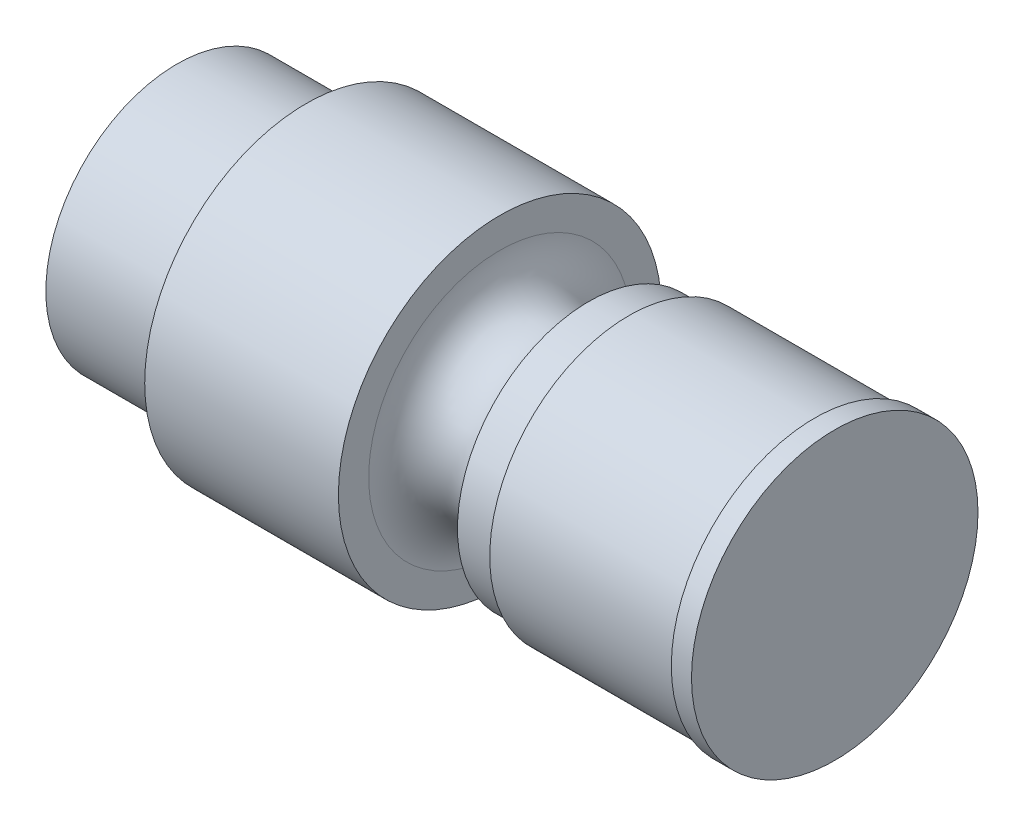
from build123d import *


with BuildPart() as part:
    # Sketch1 → Revolve1 (revolve)
    with BuildSketch(Plane.XY, mode=Mode.PRIVATE) as revolve1_sk:
        with BuildLine():
            Line((0, 0), (32, 0))
            Line((32, 0), (32, -7.5))
            Line((32, -7.5), (80, -7.5))
            Line((80, -7.5), (80, 0))
            ThreePointArc((80, 0), (91, 11), (102, 0))
            Line((102, 0), (112, 0))
            Line((112, 0), (112, -2))
            Line((112, -2), (158, -2))
            Line((158, -2), (158, -3))
            Line((158, -3), (163, -3))
            Line((163, -3), (163, 32.5))
            Line((163, 32.5), (0, 32.5))
            Line((0, 32.5), (0, 0))
        make_face()
    revolve(revolve1_sk.sketch.rotate(Axis((163, 32.5, 0), (-1, 0, 0)), 270), axis=Axis((163, 32.5, 0), (-1, 0, 0)))


solid = part.part
